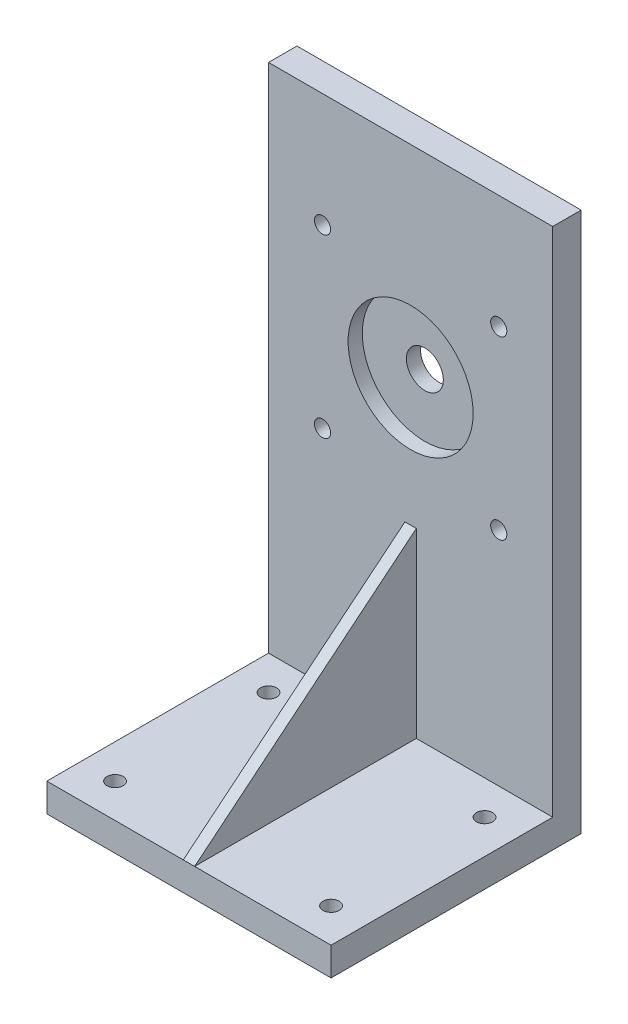
from build123d import *

# Parameters (mm, degrees)
SKETCH1_W           = 50
SKETCH1_H           = 44
BOSS_EXTRUDE1_DEPTH = 5
SKETCH2_W           = 50
SKETCH2_H           = 5
BOSS_EXTRUDE2_DEPTH = 90
SKETCH3_R           = 1.42
CUT_EXTRUDE1_DEPTH  = 60
SKETCH4_R           = 11
CUT_EXTRUDE2_DEPTH  = 2.5
SKETCH5_R           = 3.25
CUT_EXTRUDE3_DEPTH  = 10
SKETCH6_R           = 1.42
CUT_EXTRUDE4_DEPTH  = 10
SKETCH8_W           = 2
SKETCH8_H           = 39
BOSS_EXTRUDE3_DEPTH = 32
CUT_EXTRUDE5_DEPTH  = 35


with BuildPart() as part:
    # Sketch1 → Boss-Extrude1 (new body)
    with BuildSketch(Plane(origin=(0, 0, 0), x_dir=(1, 0, 0), z_dir=(0, 1, 0))):
        Rectangle(SKETCH1_W, SKETCH1_H)
    extrude(amount=BOSS_EXTRUDE1_DEPTH)

    # Sketch2 → Boss-Extrude2 (add)
    with BuildSketch(Plane(origin=(0, 5, 0), x_dir=(1, 0, 0), z_dir=(0, 1, 0))):
        with Locations((0, 19.5)):
            Rectangle(SKETCH2_W, SKETCH2_H)
    extrude(amount=BOSS_EXTRUDE2_DEPTH)

    # Sketch3 → Cut-Extrude1 (cut)
    with BuildSketch(Plane.XY.offset(-17)):
        with Locations((-15.5, 44)):
            Circle(SKETCH3_R)
        with Locations((15.5, 44)):
            Circle(SKETCH3_R)
        with Locations((15.5, 75)):
            Circle(SKETCH3_R)
        with Locations((-15.5, 75)):
            Circle(SKETCH3_R)
    extrude(amount=-CUT_EXTRUDE1_DEPTH, mode=Mode.SUBTRACT)

    # Sketch4 → Cut-Extrude2 (cut)
    with BuildSketch(Plane.XY.offset(-17)):
        with Locations((0, 59.5)):
            Circle(SKETCH4_R)
    extrude(amount=-CUT_EXTRUDE2_DEPTH, mode=Mode.SUBTRACT)

    # Sketch5 → Cut-Extrude3 (cut)
    with BuildSketch(Plane.XY.offset(-19.5)):
        with Locations((0, 59.5)):
            Circle(SKETCH5_R)
    extrude(amount=-CUT_EXTRUDE3_DEPTH, mode=Mode.SUBTRACT)

    # Sketch6 → Cut-Extrude4 (cut)
    with BuildSketch(Plane(origin=(0, 5, 0), x_dir=(1, 0, 0), z_dir=(0, 1, 0))):
        with Locations(Location((-19, 11, 0), (0, 0, 270))):
            Circle(SKETCH6_R)
        with Locations(Location((-19, -16, 0), (0, 0, 270))):
            Circle(SKETCH6_R)
        with Locations(Location((19, -16, 0), (0, 0, 270))):
            Circle(SKETCH6_R)
        with Locations(Location((19, 11, 0), (0, 0, 270))):
            Circle(SKETCH6_R)
    extrude(amount=-CUT_EXTRUDE4_DEPTH, mode=Mode.SUBTRACT)

    # Sketch8 → Boss-Extrude3 (add)
    with BuildSketch(Plane(origin=(0, 5, 0), x_dir=(1, 0, 0), z_dir=(0, 1, 0))):
        with Locations((0, -2.5)):
            Rectangle(SKETCH8_W, SKETCH8_H)
    extrude(amount=BOSS_EXTRUDE3_DEPTH)

    # Sketch9 → Cut-Extrude5 (cut)
    with BuildSketch(Plane(origin=(1, 0, 0), x_dir=(0, 0, -1), z_dir=(1, 0, 0))):
        Polygon((17, 37), (-22, 5), (-22, 37), align=None)
    extrude(amount=-CUT_EXTRUDE5_DEPTH, mode=Mode.SUBTRACT)


solid = part.part
